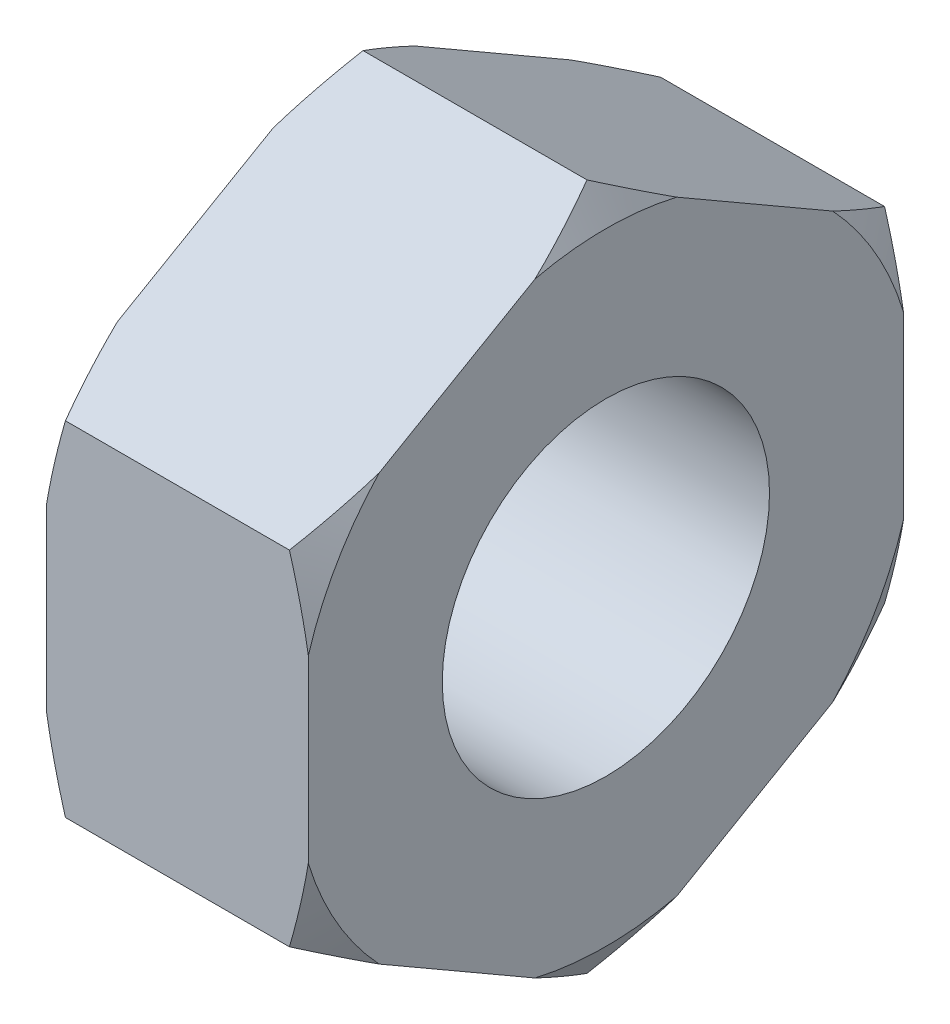
from build123d import *

# Parameters (mm, degrees)
SKETCH_3_OUTSIDE_W  = 7.43
SKETCH_3_OUTSIDE_H  = 7.43
CUT_EXTRUDE_4_DEPTH = 10


with BuildPart() as part:
    # Эскиз1 → Повернуть1 (revolve)
    with BuildSketch(Plane.XY, mode=Mode.PRIVATE) as revolve_1_sk:
        Polygon((-0.496091837, 1), (1.103908163, 1), (1.103908163, 1.9), (0.988438109, 2.1), (-0.380621783, 2.1), (-0.496091837, 1.9), align=None)
    revolve(revolve_1_sk.sketch.rotate(Axis((-3.876264999, 0, 0), (1, 0, 0)), 90), axis=Axis((-3.876264999, 0, 0), (1, 0, 0)))

    # Эскиз3 outside → Вырез-Вытянуть4 (cut)
    with BuildSketch(Plane.ZY.offset(0.496091837)):
        Rectangle(SKETCH_3_OUTSIDE_W, SKETCH_3_OUTSIDE_H)
        Polygon((0, 2.1), (-1.818653348, 1.05), (-1.818653348, -1.05), (0, -2.1), (1.818653348, -1.05), (1.818653348, 1.05), align=None, mode=Mode.SUBTRACT)
    extrude(amount=-CUT_EXTRUDE_4_DEPTH, mode=Mode.SUBTRACT)


solid = part.part
